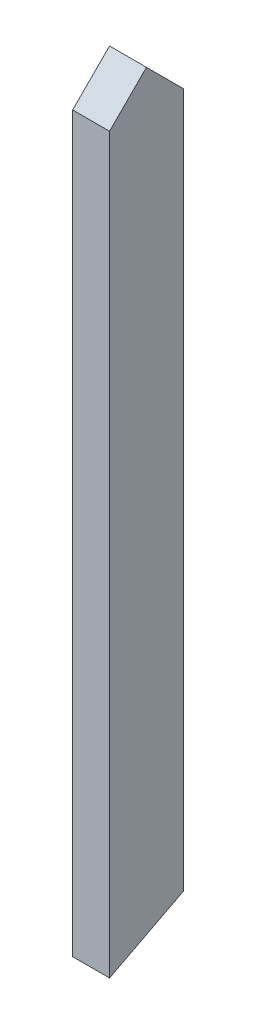
from build123d import *

# Parameters (mm, degrees)
SKETCH_1_W          = 25
SKETCH_1_H          = 50
EXTRUDE_1_DEPTH     = 521.512
CUT_EXTRUDE_1_DEPTH = 521.51
CUT_EXTRUDE_2_DEPTH = 521.51


with BuildPart() as part:
    # Эскиз1 → Бобышка-Вытянуть1 (new body)
    with BuildSketch(Plane(origin=(0, 0, 0), x_dir=(1, 0, 0), z_dir=(0, 1, 0))):
        Rectangle(SKETCH_1_W, SKETCH_1_H)
    extrude(amount=EXTRUDE_1_DEPTH)

    # Эскиз2 → Вырез-Вытянуть1 (cut)
    with BuildSketch(Plane(origin=(12.5, 0, 0), x_dir=(0, 0, -1), z_dir=(1, 0, 0))):
        Polygon((-25, 521.512), (0, 521.512), (-25, 496.512), align=None)
        Polygon((25, 0), (25, 25.90361446), (-25, 0), align=None)
    extrude(amount=-CUT_EXTRUDE_1_DEPTH, mode=Mode.SUBTRACT)

    # Эскиз3 → Вырез-Вытянуть2 (cut)
    with BuildSketch(Plane(origin=(12.5, 0, 0), x_dir=(0, 0, -1), z_dir=(1, 0, 0))):
        Polygon((0, 521.512), (25, 496.512), (25, 521.512), align=None)
    extrude(amount=-CUT_EXTRUDE_2_DEPTH, mode=Mode.SUBTRACT)


solid = part.part
